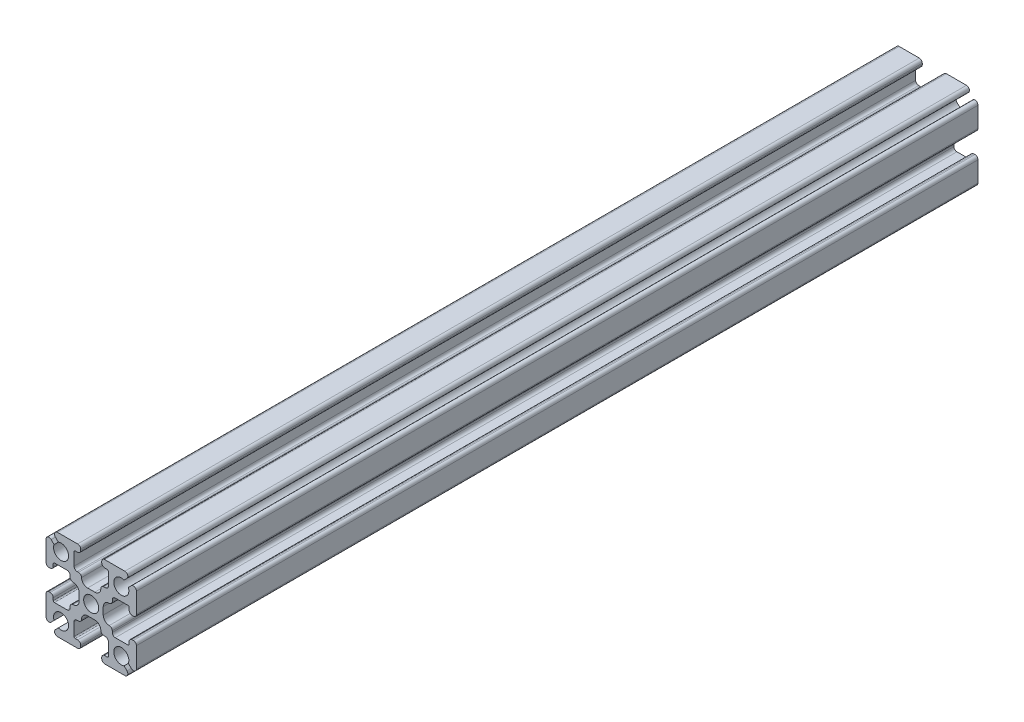
from build123d import *

# Parameters (mm, degrees)
SKETCH1_R           = 1.25
BOSS_EXTRUDE1_DEPTH = 139.7


with BuildPart() as part:
    # Sketch1 → Boss-Extrude1 (new body)
    with BuildSketch(Plane.XY):
        with BuildLine():
            Line((6.646446609, 5.939339828), (6.163645978, 5.456539197))
            ThreePointArc((6.163645978, 5.456539197), (4.116116524, 4.116116524), (5.456539197, 6.163645978))
            Line((5.456539197, 6.163645978), (5.939339828, 6.646446609))
            ThreePointArc((5.939339828, 6.646446609), (6.047726204, 7.191341716), (5.585786438, 7.5))
            Line((5.585786438, 7.5), (2.25, 7.5))
            ThreePointArc((2.25, 7.5), (1.896446609, 7.353553391), (1.75, 7))
            Line((1.75, 7), (1.75, 6.8))
            ThreePointArc((1.75, 6.8), (1.896446609, 6.446446609), (2.25, 6.3))
            Line((2.25, 6.3), (2.65, 6.3))
            ThreePointArc((2.65, 6.3), (2.791421356, 6.241421356), (2.85, 6.1))
            Line((2.85, 6.1), (2.85, 4))
            ThreePointArc((2.85, 4), (2.703553391, 3.646446609), (2.35, 3.5))
            Line((2.35, 3.5), (2.1, 3.5))
            ThreePointArc((2.1, 3.5), (1.746446609, 3.353553391), (1.6, 3))
            ThreePointArc((1.6, 3), (1.307106781, 2.292893219), (0.6, 2))
            Line((0.6, 2), (-0.6, 2))
            ThreePointArc((-0.6, 2), (-1.307106781, 2.292893219), (-1.6, 3))
            ThreePointArc((-1.6, 3), (-1.746446609, 3.353553391), (-2.1, 3.5))
            Line((-2.1, 3.5), (-2.35, 3.5))
            ThreePointArc((-2.35, 3.5), (-2.703553391, 3.646446609), (-2.85, 4))
            Line((-2.85, 4), (-2.85, 6.1))
            ThreePointArc((-2.85, 6.1), (-2.791421356, 6.241421356), (-2.65, 6.3))
            Line((-2.65, 6.3), (-2.25, 6.3))
            ThreePointArc((-2.25, 6.3), (-1.896446609, 6.446446609), (-1.75, 6.8))
            Line((-1.75, 6.8), (-1.75, 7))
            ThreePointArc((-1.75, 7), (-1.896446609, 7.353553391), (-2.25, 7.5))
            Line((-2.25, 7.5), (-5.585786438, 7.5))
            ThreePointArc((-5.585786438, 7.5), (-6.047726204, 7.191341716), (-5.939339828, 6.646446609))
            Line((-5.939339828, 6.646446609), (-5.456539197, 6.163645978))
            ThreePointArc((-5.456539197, 6.163645978), (-4.116116524, 4.116116524), (-6.163645978, 5.456539197))
            Line((-6.163645978, 5.456539197), (-6.646446609, 5.939339828))
            ThreePointArc((-6.646446609, 5.939339828), (-7.191341716, 6.047726204), (-7.5, 5.585786438))
            Line((-7.5, 5.585786438), (-7.5, 2.25))
            ThreePointArc((-7.5, 2.25), (-7.353553391, 1.896446609), (-7, 1.75))
            Line((-7, 1.75), (-6.8, 1.75))
            ThreePointArc((-6.8, 1.75), (-6.446446609, 1.896446609), (-6.3, 2.25))
            Line((-6.3, 2.25), (-6.3, 2.65))
            ThreePointArc((-6.3, 2.65), (-6.241421356, 2.791421356), (-6.1, 2.85))
            Line((-6.1, 2.85), (-4, 2.85))
            ThreePointArc((-4, 2.85), (-3.646446609, 2.703553391), (-3.5, 2.35))
            Line((-3.5, 2.35), (-3.5, 2.1))
            ThreePointArc((-3.5, 2.1), (-3.353553391, 1.746446609), (-3, 1.6))
            ThreePointArc((-3, 1.6), (-2.292893219, 1.307106781), (-2, 0.6))
            Line((-2, 0.6), (-2, -0.6))
            ThreePointArc((-2, -0.6), (-2.292893219, -1.307106781), (-3, -1.6))
            ThreePointArc((-3, -1.6), (-3.353553391, -1.746446609), (-3.5, -2.1))
            Line((-3.5, -2.1), (-3.5, -2.35))
            ThreePointArc((-3.5, -2.35), (-3.646446609, -2.703553391), (-4, -2.85))
            Line((-4, -2.85), (-6.1, -2.85))
            ThreePointArc((-6.1, -2.85), (-6.241421356, -2.791421356), (-6.3, -2.65))
            Line((-6.3, -2.65), (-6.3, -2.25))
            ThreePointArc((-6.3, -2.25), (-6.446446609, -1.896446609), (-6.8, -1.75))
            Line((-6.8, -1.75), (-7, -1.75))
            ThreePointArc((-7, -1.75), (-7.353553391, -1.896446609), (-7.5, -2.25))
            Line((-7.5, -2.25), (-7.5, -5.585786438))
            ThreePointArc((-7.5, -5.585786438), (-7.191341716, -6.047726204), (-6.646446609, -5.939339828))
            Line((-6.646446609, -5.939339828), (-6.163645978, -5.456539197))
            ThreePointArc((-6.163645978, -5.456539197), (-4.116116524, -4.116116524), (-5.456539197, -6.163645978))
            Line((-5.456539197, -6.163645978), (-5.939339828, -6.646446609))
            ThreePointArc((-5.939339828, -6.646446609), (-6.047726204, -7.191341716), (-5.585786438, -7.5))
            Line((-5.585786438, -7.5), (-2.25, -7.5))
            ThreePointArc((-2.25, -7.5), (-1.896446609, -7.353553391), (-1.75, -7))
            Line((-1.75, -7), (-1.75, -6.8))
            ThreePointArc((-1.75, -6.8), (-1.896446609, -6.446446609), (-2.25, -6.3))
            Line((-2.25, -6.3), (-2.65, -6.3))
            ThreePointArc((-2.65, -6.3), (-2.791421356, -6.241421356), (-2.85, -6.1))
            Line((-2.85, -6.1), (-2.85, -4))
            ThreePointArc((-2.85, -4), (-2.703553391, -3.646446609), (-2.35, -3.5))
            Line((-2.35, -3.5), (-2.1, -3.5))
            ThreePointArc((-2.1, -3.5), (-1.746446609, -3.353553391), (-1.6, -3))
            ThreePointArc((-1.6, -3), (-1.307106781, -2.292893219), (-0.6, -2))
            Line((-0.6, -2), (0.6, -2))
            ThreePointArc((0.6, -2), (1.307106781, -2.292893219), (1.6, -3))
            ThreePointArc((1.6, -3), (1.746446609, -3.353553391), (2.1, -3.5))
            Line((2.1, -3.5), (2.35, -3.5))
            ThreePointArc((2.35, -3.5), (2.703553391, -3.646446609), (2.85, -4))
            Line((2.85, -4), (2.85, -6.1))
            ThreePointArc((2.85, -6.1), (2.791421356, -6.241421356), (2.65, -6.3))
            Line((2.65, -6.3), (2.25, -6.3))
            ThreePointArc((2.25, -6.3), (1.896446609, -6.446446609), (1.75, -6.8))
            Line((1.75, -6.8), (1.75, -7))
            ThreePointArc((1.75, -7), (1.896446609, -7.353553391), (2.25, -7.5))
            Line((2.25, -7.5), (5.585786438, -7.5))
            ThreePointArc((5.585786438, -7.5), (6.047726204, -7.191341716), (5.939339828, -6.646446609))
            Line((5.939339828, -6.646446609), (5.456539197, -6.163645978))
            ThreePointArc((5.456539197, -6.163645978), (4.116116524, -4.116116524), (6.163645978, -5.456539197))
            Line((6.163645978, -5.456539197), (6.646446609, -5.939339828))
            ThreePointArc((6.646446609, -5.939339828), (7.191341716, -6.047726204), (7.5, -5.585786438))
            Line((7.5, -5.585786438), (7.5, -2.25))
            ThreePointArc((7.5, -2.25), (7.353553391, -1.896446609), (7, -1.75))
            Line((7, -1.75), (6.8, -1.75))
            ThreePointArc((6.8, -1.75), (6.446446609, -1.896446609), (6.3, -2.25))
            Line((6.3, -2.25), (6.3, -2.65))
            ThreePointArc((6.3, -2.65), (6.241421356, -2.791421356), (6.1, -2.85))
            Line((6.1, -2.85), (4, -2.85))
            ThreePointArc((4, -2.85), (3.646446609, -2.703553391), (3.5, -2.35))
            Line((3.5, -2.35), (3.5, -2.1))
            ThreePointArc((3.5, -2.1), (3.353553391, -1.746446609), (3, -1.6))
            ThreePointArc((3, -1.6), (2.292893219, -1.307106781), (2, -0.6))
            Line((2, -0.6), (2, 0.6))
            ThreePointArc((2, 0.6), (2.292893219, 1.307106781), (3, 1.6))
            ThreePointArc((3, 1.6), (3.353553391, 1.746446609), (3.5, 2.1))
            Line((3.5, 2.1), (3.5, 2.35))
            ThreePointArc((3.5, 2.35), (3.646446609, 2.703553391), (4, 2.85))
            Line((4, 2.85), (6.1, 2.85))
            ThreePointArc((6.1, 2.85), (6.241421356, 2.791421356), (6.3, 2.65))
            Line((6.3, 2.65), (6.3, 2.25))
            ThreePointArc((6.3, 2.25), (6.446446609, 1.896446609), (6.8, 1.75))
            Line((6.8, 1.75), (7, 1.75))
            ThreePointArc((7, 1.75), (7.353553391, 1.896446609), (7.5, 2.25))
            Line((7.5, 2.25), (7.5, 5.585786438))
            ThreePointArc((7.5, 5.585786438), (7.191341716, 6.047726204), (6.646446609, 5.939339828))
        make_face()
        with Locations(Location((0, 0, 0), (0, 0, 180))):
            Circle(SKETCH1_R, mode=Mode.SUBTRACT)
    extrude(amount=BOSS_EXTRUDE1_DEPTH)


solid = part.part
